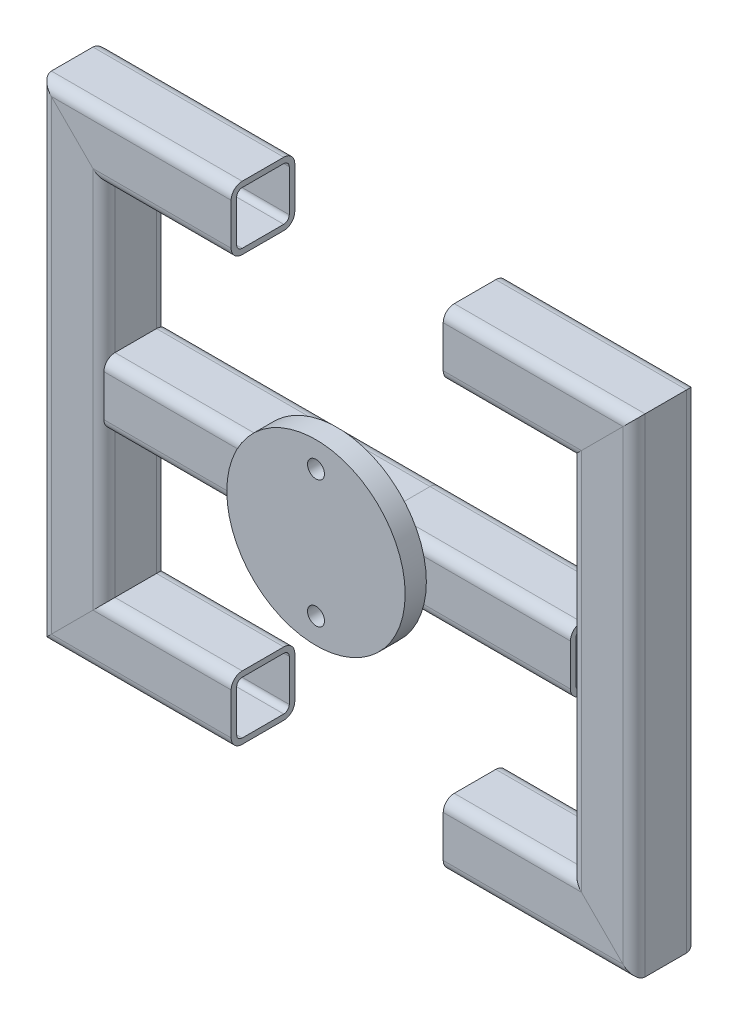
from build123d import *

# Parameters (mm, degrees)
SQUARE_TUBE_30_X_30_X_2_6_1_DEPTH        = 97.213203436
SQUARE_TUBE_30_X_30_X_2_6_1_2_DEPTH      = 244.426406871
SQUARE_TUBE_30_X_30_X_2_6_1_3_DEPTH      = 75
SQUARE_TUBE_30_X_30_X_2_6_1_3_DEPTH_BACK = 22.213203436
SQUARE_TUBE_30_X_30_X_2_6_1_4_DEPTH      = 97.213203436
SQUARE_TUBE_30_X_30_X_2_6_1_5_DEPTH      = 244.426406871
SQUARE_TUBE_30_X_30_X_2_6_1_6_DEPTH      = 97.213203436
SQUARE_TUBE_30_X_30_X_2_6_1_7_DEPTH      = 107
SQUARE_TUBE_30_X_30_X_2_6_1_8_DEPTH      = 107
SQUARE_TUBE_30_X_30_X_2_6_1_9_DEPTH      = 38
SKETCH17_R                               = 42.055
BOSS_EXTRUDE1_DEPTH                      = 10
SKETCH18_R                               = 4
CUT_EXTRUDE1_DEPTH                       = 10


with BuildPart() as part:
    # Sketch16 on segment 1 (carried to segment 1) → Square tube 30 X 30 X 2.6(1) (new body)
    with BuildSketch(Plane(origin=(-50, -100, 0), x_dir=(0, -1, 0), z_dir=(-1, 0, 0))):
        with BuildLine():
            Line((-9.8, -15), (9.8, -15))
            ThreePointArc((9.8, -15), (13.476955262, -13.476955262), (15, -9.8))
            Line((15, -9.8), (15, 9.8))
            ThreePointArc((15, 9.8), (13.476955262, 13.476955262), (9.8, 15))
            Line((9.8, 15), (-9.8, 15))
            ThreePointArc((-9.8, 15), (-13.476955262, 13.476955262), (-15, 9.8))
            Line((-15, 9.8), (-15, -9.8))
            ThreePointArc((-15, -9.8), (-13.476955262, -13.476955262), (-9.8, -15))
        make_face()
        with BuildLine():
            Line((-9.8, -12.4), (9.8, -12.4))
            ThreePointArc((9.8, -12.4), (11.638477631, -11.638477631), (12.4, -9.8))
            Line((12.4, -9.8), (12.4, 9.8))
            ThreePointArc((12.4, 9.8), (11.638477631, 11.638477631), (9.8, 12.4))
            Line((9.8, 12.4), (-9.8, 12.4))
            ThreePointArc((-9.8, 12.4), (-11.638477631, 11.638477631), (-12.4, 9.8))
            Line((-12.4, 9.8), (-12.4, -9.8))
            ThreePointArc((-12.4, -9.8), (-11.638477631, -11.638477631), (-9.8, -12.4))
        make_face(mode=Mode.SUBTRACT)
    extrude(amount=SQUARE_TUBE_30_X_30_X_2_6_1_DEPTH)

    # Square tube 30 X 30 X 2.6(1) mitre 1
    split(bisect_by=Plane(origin=(-125, -100, 0), x_dir=(0.707106781, 0.707106781, 0), z_dir=(0.707106781, -0.707106781, 0)), keep=Keep.TOP)


with BuildPart() as body_2:
    # Sketch16 on segment 2 (carried to segment 2) → Square tube 30 X 30 X 2.6_1 2 (new body)
    with BuildSketch(Plane(origin=(-125, -122.213203436, 0), x_dir=(-1, 0, 0), z_dir=(0, 1, 0))):
        with BuildLine():
            Line((-9.8, -15), (9.8, -15))
            ThreePointArc((9.8, -15), (13.476955262, -13.476955262), (15, -9.8))
            Line((15, -9.8), (15, 9.8))
            ThreePointArc((15, 9.8), (13.476955262, 13.476955262), (9.8, 15))
            Line((9.8, 15), (-9.8, 15))
            ThreePointArc((-9.8, 15), (-13.476955262, 13.476955262), (-15, 9.8))
            Line((-15, 9.8), (-15, -9.8))
            ThreePointArc((-15, -9.8), (-13.476955262, -13.476955262), (-9.8, -15))
        make_face()
        with BuildLine():
            Line((-9.8, -12.4), (9.8, -12.4))
            ThreePointArc((9.8, -12.4), (11.638477631, -11.638477631), (12.4, -9.8))
            Line((12.4, -9.8), (12.4, 9.8))
            ThreePointArc((12.4, 9.8), (11.638477631, 11.638477631), (9.8, 12.4))
            Line((9.8, 12.4), (-9.8, 12.4))
            ThreePointArc((-9.8, 12.4), (-11.638477631, 11.638477631), (-12.4, 9.8))
            Line((-12.4, 9.8), (-12.4, -9.8))
            ThreePointArc((-12.4, -9.8), (-11.638477631, -11.638477631), (-9.8, -12.4))
        make_face(mode=Mode.SUBTRACT)
    extrude(amount=SQUARE_TUBE_30_X_30_X_2_6_1_2_DEPTH)

    # Square tube 30 X 30 X 2.6_1 2 mitre 1
    split(bisect_by=Plane(origin=(-125, 100, 0), x_dir=(0.707106781, -0.707106781, 0), z_dir=(-0.707106781, -0.707106781, 0)), keep=Keep.TOP)

    # Square tube 30 X 30 X 2.6_1 2 mitre 2
    split(bisect_by=Plane(origin=(-125, -100, 0), x_dir=(-0.707106781, -0.707106781, 0), z_dir=(-0.707106781, 0.707106781, 0)), keep=Keep.TOP)


with BuildPart() as body_3:
    # Sketch16 → Square tube 30 X 30 X 2.6_1 3 (new, two sides: drawn at the far end of the back side and taken through both)
    with BuildSketch(Plane(origin=(-125, 100, 0), x_dir=(0, 1, 0), z_dir=(1, 0, 0)).offset(-SQUARE_TUBE_30_X_30_X_2_6_1_3_DEPTH_BACK)):
        with BuildLine():
            Line((-9.8, -15), (9.8, -15))
            ThreePointArc((9.8, -15), (13.476955262, -13.476955262), (15, -9.8))
            Line((15, -9.8), (15, 9.8))
            ThreePointArc((15, 9.8), (13.476955262, 13.476955262), (9.8, 15))
            Line((9.8, 15), (-9.8, 15))
            ThreePointArc((-9.8, 15), (-13.476955262, 13.476955262), (-15, 9.8))
            Line((-15, 9.8), (-15, -9.8))
            ThreePointArc((-15, -9.8), (-13.476955262, -13.476955262), (-9.8, -15))
        make_face()
        with BuildLine():
            Line((-9.8, -12.4), (9.8, -12.4))
            ThreePointArc((9.8, -12.4), (11.638477631, -11.638477631), (12.4, -9.8))
            Line((12.4, -9.8), (12.4, 9.8))
            ThreePointArc((12.4, 9.8), (11.638477631, 11.638477631), (9.8, 12.4))
            Line((9.8, 12.4), (-9.8, 12.4))
            ThreePointArc((-9.8, 12.4), (-11.638477631, 11.638477631), (-12.4, 9.8))
            Line((-12.4, 9.8), (-12.4, -9.8))
            ThreePointArc((-12.4, -9.8), (-11.638477631, -11.638477631), (-9.8, -12.4))
        make_face(mode=Mode.SUBTRACT)
    extrude(amount=SQUARE_TUBE_30_X_30_X_2_6_1_3_DEPTH + SQUARE_TUBE_30_X_30_X_2_6_1_3_DEPTH_BACK)

    # Square tube 30 X 30 X 2.6_1 3 mitre 1
    split(bisect_by=Plane(origin=(-125, 100, 0), x_dir=(-0.707106781, 0.707106781, 0), z_dir=(0.707106781, 0.707106781, 0)), keep=Keep.TOP)


with BuildPart() as body_4:
    # Sketch16 on segment 4 (carried to segment 4) → Square tube 30 X 30 X 2.6_1 4 (new body)
    with BuildSketch(Plane(origin=(50, 100, 0), x_dir=(0, 1, 0), z_dir=(1, 0, 0))):
        with BuildLine():
            Line((-9.8, -15), (9.8, -15))
            ThreePointArc((9.8, -15), (13.476955262, -13.476955262), (15, -9.8))
            Line((15, -9.8), (15, 9.8))
            ThreePointArc((15, 9.8), (13.476955262, 13.476955262), (9.8, 15))
            Line((9.8, 15), (-9.8, 15))
            ThreePointArc((-9.8, 15), (-13.476955262, 13.476955262), (-15, 9.8))
            Line((-15, 9.8), (-15, -9.8))
            ThreePointArc((-15, -9.8), (-13.476955262, -13.476955262), (-9.8, -15))
        make_face()
        with BuildLine():
            Line((-9.8, -12.4), (9.8, -12.4))
            ThreePointArc((9.8, -12.4), (11.638477631, -11.638477631), (12.4, -9.8))
            Line((12.4, -9.8), (12.4, 9.8))
            ThreePointArc((12.4, 9.8), (11.638477631, 11.638477631), (9.8, 12.4))
            Line((9.8, 12.4), (-9.8, 12.4))
            ThreePointArc((-9.8, 12.4), (-11.638477631, 11.638477631), (-12.4, 9.8))
            Line((-12.4, 9.8), (-12.4, -9.8))
            ThreePointArc((-12.4, -9.8), (-11.638477631, -11.638477631), (-9.8, -12.4))
        make_face(mode=Mode.SUBTRACT)
    extrude(amount=SQUARE_TUBE_30_X_30_X_2_6_1_4_DEPTH)

    # Square tube 30 X 30 X 2.6_1 4 mitre 1
    split(bisect_by=Plane(origin=(125, 100, 0), x_dir=(-0.707106781, -0.707106781, 0), z_dir=(-0.707106781, 0.707106781, 0)), keep=Keep.TOP)


with BuildPart() as body_5:
    # Sketch16 on segment 5 (carried to segment 5) → Square tube 30 X 30 X 2.6_1 5 (new body)
    with BuildSketch(Plane(origin=(125, 122.213203436, 0), x_dir=(1, 0, 0), z_dir=(0, -1, 0))):
        with BuildLine():
            Line((-9.8, -15), (9.8, -15))
            ThreePointArc((9.8, -15), (13.476955262, -13.476955262), (15, -9.8))
            Line((15, -9.8), (15, 9.8))
            ThreePointArc((15, 9.8), (13.476955262, 13.476955262), (9.8, 15))
            Line((9.8, 15), (-9.8, 15))
            ThreePointArc((-9.8, 15), (-13.476955262, 13.476955262), (-15, 9.8))
            Line((-15, 9.8), (-15, -9.8))
            ThreePointArc((-15, -9.8), (-13.476955262, -13.476955262), (-9.8, -15))
        make_face()
        with BuildLine():
            Line((-9.8, -12.4), (9.8, -12.4))
            ThreePointArc((9.8, -12.4), (11.638477631, -11.638477631), (12.4, -9.8))
            Line((12.4, -9.8), (12.4, 9.8))
            ThreePointArc((12.4, 9.8), (11.638477631, 11.638477631), (9.8, 12.4))
            Line((9.8, 12.4), (-9.8, 12.4))
            ThreePointArc((-9.8, 12.4), (-11.638477631, 11.638477631), (-12.4, 9.8))
            Line((-12.4, 9.8), (-12.4, -9.8))
            ThreePointArc((-12.4, -9.8), (-11.638477631, -11.638477631), (-9.8, -12.4))
        make_face(mode=Mode.SUBTRACT)
    extrude(amount=SQUARE_TUBE_30_X_30_X_2_6_1_5_DEPTH)

    # Square tube 30 X 30 X 2.6_1 5 mitre 1
    split(bisect_by=Plane(origin=(125, 100, 0), x_dir=(0.707106781, 0.707106781, 0), z_dir=(0.707106781, -0.707106781, 0)), keep=Keep.TOP)

    # Square tube 30 X 30 X 2.6_1 5 mitre 2
    split(bisect_by=Plane(origin=(125, -100, 0), x_dir=(-0.707106781, 0.707106781, 0), z_dir=(0.707106781, 0.707106781, 0)), keep=Keep.TOP)


with BuildPart() as body_6:
    # Sketch16 on segment 6 (carried to segment 6) → Square tube 30 X 30 X 2.6_1 6 (new body)
    with BuildSketch(Plane(origin=(147.213203436, -100, 0), x_dir=(0, -1, 0), z_dir=(-1, 0, 0))):
        with BuildLine():
            Line((-9.8, -15), (9.8, -15))
            ThreePointArc((9.8, -15), (13.476955262, -13.476955262), (15, -9.8))
            Line((15, -9.8), (15, 9.8))
            ThreePointArc((15, 9.8), (13.476955262, 13.476955262), (9.8, 15))
            Line((9.8, 15), (-9.8, 15))
            ThreePointArc((-9.8, 15), (-13.476955262, 13.476955262), (-15, 9.8))
            Line((-15, 9.8), (-15, -9.8))
            ThreePointArc((-15, -9.8), (-13.476955262, -13.476955262), (-9.8, -15))
        make_face()
        with BuildLine():
            Line((-9.8, -12.4), (9.8, -12.4))
            ThreePointArc((9.8, -12.4), (11.638477631, -11.638477631), (12.4, -9.8))
            Line((12.4, -9.8), (12.4, 9.8))
            ThreePointArc((12.4, 9.8), (11.638477631, 11.638477631), (9.8, 12.4))
            Line((9.8, 12.4), (-9.8, 12.4))
            ThreePointArc((-9.8, 12.4), (-11.638477631, 11.638477631), (-12.4, 9.8))
            Line((-12.4, 9.8), (-12.4, -9.8))
            ThreePointArc((-12.4, -9.8), (-11.638477631, -11.638477631), (-9.8, -12.4))
        make_face(mode=Mode.SUBTRACT)
    extrude(amount=SQUARE_TUBE_30_X_30_X_2_6_1_6_DEPTH)

    # Square tube 30 X 30 X 2.6_1 6 mitre 1
    split(bisect_by=Plane(origin=(125, -100, 0), x_dir=(0.707106781, -0.707106781, 0), z_dir=(-0.707106781, -0.707106781, 0)), keep=Keep.TOP)


with BuildPart() as body_7:
    # Sketch16 on segment 7 (carried to segment 7) → Square tube 30 X 30 X 2.6_1 7 (new body)
    with BuildSketch(Plane(origin=(-19, 0, 0), x_dir=(0, -1, 0), z_dir=(-1, 0, 0))):
        with BuildLine():
            Line((-9.8, -15), (9.8, -15))
            ThreePointArc((9.8, -15), (13.476955262, -13.476955262), (15, -9.8))
            Line((15, -9.8), (15, 9.8))
            ThreePointArc((15, 9.8), (13.476955262, 13.476955262), (9.8, 15))
            Line((9.8, 15), (-9.8, 15))
            ThreePointArc((-9.8, 15), (-13.476955262, 13.476955262), (-15, 9.8))
            Line((-15, 9.8), (-15, -9.8))
            ThreePointArc((-15, -9.8), (-13.476955262, -13.476955262), (-9.8, -15))
        make_face()
        with BuildLine():
            Line((-9.8, -12.4), (9.8, -12.4))
            ThreePointArc((9.8, -12.4), (11.638477631, -11.638477631), (12.4, -9.8))
            Line((12.4, -9.8), (12.4, 9.8))
            ThreePointArc((12.4, 9.8), (11.638477631, 11.638477631), (9.8, 12.4))
            Line((9.8, 12.4), (-9.8, 12.4))
            ThreePointArc((-9.8, 12.4), (-11.638477631, 11.638477631), (-12.4, 9.8))
            Line((-12.4, 9.8), (-12.4, -9.8))
            ThreePointArc((-12.4, -9.8), (-11.638477631, -11.638477631), (-9.8, -12.4))
        make_face(mode=Mode.SUBTRACT)
    extrude(amount=SQUARE_TUBE_30_X_30_X_2_6_1_7_DEPTH)

    # Square tube 30 X 30 X 2.6_1 7 mitre 1
    split(bisect_by=Plane.YZ.offset(-110), keep=Keep.TOP)


with BuildPart() as body_8:
    # Sketch16 on segment 8 (carried to segment 8) → Square tube 30 X 30 X 2.6_1 8 (new body)
    with BuildSketch(Plane.YZ.offset(19)):
        with BuildLine():
            Line((-9.8, -15), (9.8, -15))
            ThreePointArc((9.8, -15), (13.476955262, -13.476955262), (15, -9.8))
            Line((15, -9.8), (15, 9.8))
            ThreePointArc((15, 9.8), (13.476955262, 13.476955262), (9.8, 15))
            Line((9.8, 15), (-9.8, 15))
            ThreePointArc((-9.8, 15), (-13.476955262, 13.476955262), (-15, 9.8))
            Line((-15, 9.8), (-15, -9.8))
            ThreePointArc((-15, -9.8), (-13.476955262, -13.476955262), (-9.8, -15))
        make_face()
        with BuildLine():
            Line((-9.8, -12.4), (9.8, -12.4))
            ThreePointArc((9.8, -12.4), (11.638477631, -11.638477631), (12.4, -9.8))
            Line((12.4, -9.8), (12.4, 9.8))
            ThreePointArc((12.4, 9.8), (11.638477631, 11.638477631), (9.8, 12.4))
            Line((9.8, 12.4), (-9.8, 12.4))
            ThreePointArc((-9.8, 12.4), (-11.638477631, 11.638477631), (-12.4, 9.8))
            Line((-12.4, 9.8), (-12.4, -9.8))
            ThreePointArc((-12.4, -9.8), (-11.638477631, -11.638477631), (-9.8, -12.4))
        make_face(mode=Mode.SUBTRACT)
    extrude(amount=SQUARE_TUBE_30_X_30_X_2_6_1_8_DEPTH)

    # Square tube 30 X 30 X 2.6_1 8 mitre 1
    split(bisect_by=Plane(origin=(110, 0, 0), x_dir=(0, -1, 0), z_dir=(-1, 0, 0)), keep=Keep.TOP)


with BuildPart() as body_9:
    # Sketch16 on segment 9 (carried to segment 9) → Square tube 30 X 30 X 2.6_1 9 (new body)
    with BuildSketch(Plane(origin=(19, 0, 0), x_dir=(0, -1, 0), z_dir=(-1, 0, 0))):
        with BuildLine():
            Line((-9.8, -15), (9.8, -15))
            ThreePointArc((9.8, -15), (13.476955262, -13.476955262), (15, -9.8))
            Line((15, -9.8), (15, 9.8))
            ThreePointArc((15, 9.8), (13.476955262, 13.476955262), (9.8, 15))
            Line((9.8, 15), (-9.8, 15))
            ThreePointArc((-9.8, 15), (-13.476955262, 13.476955262), (-15, 9.8))
            Line((-15, 9.8), (-15, -9.8))
            ThreePointArc((-15, -9.8), (-13.476955262, -13.476955262), (-9.8, -15))
        make_face()
        with BuildLine():
            Line((-9.8, -12.4), (9.8, -12.4))
            ThreePointArc((9.8, -12.4), (11.638477631, -11.638477631), (12.4, -9.8))
            Line((12.4, -9.8), (12.4, 9.8))
            ThreePointArc((12.4, 9.8), (11.638477631, 11.638477631), (9.8, 12.4))
            Line((9.8, 12.4), (-9.8, 12.4))
            ThreePointArc((-9.8, 12.4), (-11.638477631, 11.638477631), (-12.4, 9.8))
            Line((-12.4, 9.8), (-12.4, -9.8))
            ThreePointArc((-12.4, -9.8), (-11.638477631, -11.638477631), (-9.8, -12.4))
        make_face(mode=Mode.SUBTRACT)
    extrude(amount=SQUARE_TUBE_30_X_30_X_2_6_1_9_DEPTH)


with BuildPart() as body_10:
    # Sketch17 → Boss-Extrude1 (new body)
    with BuildSketch(Plane.XY.offset(15)):
        Circle(SKETCH17_R)
    extrude(amount=BOSS_EXTRUDE1_DEPTH)

    # Sketch18 → Cut-Extrude1 (cut)
    with BuildSketch(Plane.XY.offset(25)):
        with Locations((0, 30)):
            Circle(SKETCH18_R)
        with Locations((0, -30)):
            Circle(SKETCH18_R)
    extrude(amount=-CUT_EXTRUDE1_DEPTH, mode=Mode.SUBTRACT)


solid = Compound([part.part, body_2.part, body_3.part, body_4.part, body_5.part, body_6.part, body_7.part, body_8.part, body_9.part, body_10.part])
